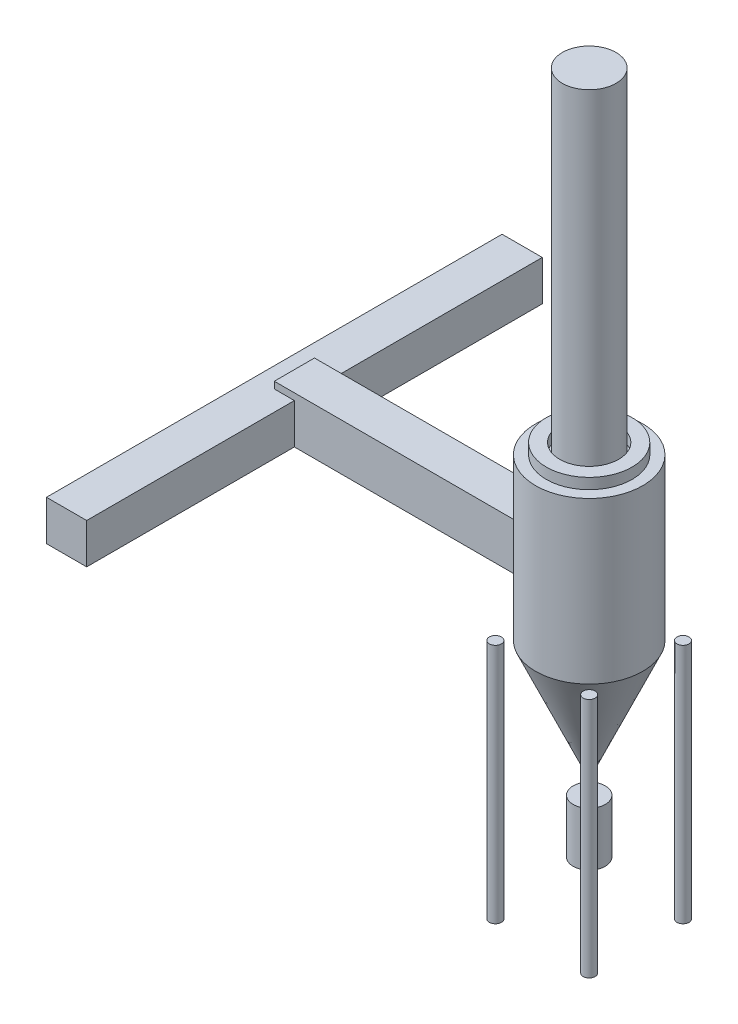
from build123d import *

# Parameters (mm, degrees)
SKETCH1_R            = 45
BOSS_EXTRUDE1_DEPTH  = 1800
SKETCH2_R            = 45
BOSS_EXTRUDE2_DEPTH  = 1800
SKETCH3_R            = 45
BOSS_EXTRUDE3_DEPTH  = 1800
SKETCH4_R            = 45
BOSS_EXTRUDE4_DEPTH  = 1800
BOSS_EXTRUDE5_START  = 400
SKETCH5_R            = 120
BOSS_EXTRUDE5_DEPTH  = 400
BOSS_EXTRUDE7_START  = 1800
SKETCH7_R            = 400
BOSS_EXTRUDE7_DEPTH  = 1200
BOSS_EXTRUDE8_START  = 3000
SKETCH8_R            = 200
BOSS_EXTRUDE8_DEPTH  = 2500
BOSS_EXTRUDE9_START  = 3000
SKETCH9_R            = 320
SKETCH9_R_2          = 220
BOSS_EXTRUDE9_DEPTH  = 80
BOSS_EXTRUDE10_START = 2100
SKETCH10_W           = 300
SKETCH10_H           = 3400
BOSS_EXTRUDE10_DEPTH = 300
BOSS_EXTRUDE11_START = 2100
SKETCH11_W           = 1800
SKETCH11_H           = 300
BOSS_EXTRUDE11_DEPTH = 350


with BuildPart() as part:
    # Sketch1 → Boss-Extrude1 (new body)
    with BuildSketch(Plane(origin=(0, 0, 0), x_dir=(1, 0, 0), z_dir=(0, 1, 0))):
        with Locations(Location((1850, 5150, 0), (0, 0, 270))):
            Circle(SKETCH1_R)
    extrude(amount=BOSS_EXTRUDE1_DEPTH)


with BuildPart() as body_2:
    # Sketch2 → Boss-Extrude2 (new body)
    with BuildSketch(Plane(origin=(0, 0, 0), x_dir=(1, 0, 0), z_dir=(0, 1, 0))):
        with Locations(Location((2550, 5150, 0), (0, 0, 270))):
            Circle(SKETCH2_R)
    extrude(amount=BOSS_EXTRUDE2_DEPTH)


with BuildPart() as body_3:
    # Sketch3 → Boss-Extrude3 (new body)
    with BuildSketch(Plane(origin=(0, 0, 0), x_dir=(1, 0, 0), z_dir=(0, 1, 0))):
        with Locations(Location((1850, 5850, 0), (0, 0, 270))):
            Circle(SKETCH3_R)
    extrude(amount=BOSS_EXTRUDE3_DEPTH)


with BuildPart() as body_4:
    # Sketch4 → Boss-Extrude4 (new body)
    with BuildSketch(Plane(origin=(0, 0, 0), x_dir=(1, 0, 0), z_dir=(0, 1, 0))):
        with Locations(Location((2550, 5850, 0), (0, 0, 270))):
            Circle(SKETCH4_R)
    extrude(amount=BOSS_EXTRUDE4_DEPTH)


with BuildPart() as body_5:
    # Sketch5 → Boss-Extrude5 (new body)
    with BuildSketch(Plane(origin=(0, 0, 0), x_dir=(1, 0, 0), z_dir=(0, 1, 0)).offset(BOSS_EXTRUDE5_START)):
        with Locations(Location((2200, 5500, 0), (0, 0, 270))):
            Circle(SKETCH5_R)
    extrude(amount=BOSS_EXTRUDE5_DEPTH)


with BuildPart() as body_6:
    # Boss-Extrude6 cone 1 section (through the dimple's axis) → Boss-Extrude6 (revolve)
    with BuildSketch(Plane(origin=(2200, 1800, -5500), x_dir=(0, 0, 1), z_dir=(1, 0, 0))):
        Polygon((0, 0), (400, 0), (0, 898.414709562), align=None)
    revolve(axis=Axis((2200, 1800, -5500), (0, -1, 0)))

    # Sketch7 → Boss-Extrude7 (add)
    with BuildSketch(Plane(origin=(0, 0, 0), x_dir=(1, 0, 0), z_dir=(0, 1, 0)).offset(BOSS_EXTRUDE7_START)):
        with Locations(Location((2200, 5500, 0), (0, 0, 270))):
            Circle(SKETCH7_R)
    extrude(amount=BOSS_EXTRUDE7_DEPTH)

    # Sketch8 → Boss-Extrude8 (add)
    with BuildSketch(Plane(origin=(0, 0, 0), x_dir=(1, 0, 0), z_dir=(0, 1, 0)).offset(BOSS_EXTRUDE8_START)):
        with Locations(Location((2200, 5500, 0), (0, 0, 270))):
            Circle(SKETCH8_R)
    extrude(amount=BOSS_EXTRUDE8_DEPTH)

    # Sketch9 → Boss-Extrude9 (add)
    with BuildSketch(Plane(origin=(0, 0, 0), x_dir=(1, 0, 0), z_dir=(0, 1, 0)).offset(BOSS_EXTRUDE9_START)):
        with Locations(Location((2200, 5500, 0), (0, 0, 270))):
            Circle(SKETCH9_R)
        with Locations(Location((2200, 5500, 0), (0, 0, 270))):
            Circle(SKETCH9_R_2, mode=Mode.SUBTRACT)
    extrude(amount=BOSS_EXTRUDE9_DEPTH)


with BuildPart() as body_7:
    # Sketch10 → Boss-Extrude10 (new body)
    with BuildSketch(Plane(origin=(0, 0, 0), x_dir=(1, 0, 0), z_dir=(0, 1, 0)).offset(BOSS_EXTRUDE10_START)):
        with Locations((0, 5500)):
            Rectangle(SKETCH10_W, SKETCH10_H)
    extrude(amount=BOSS_EXTRUDE10_DEPTH)

    # Sketch11 → Boss-Extrude11 (add)
    with BuildSketch(Plane(origin=(0, 0, 0), x_dir=(1, 0, 0), z_dir=(0, 1, 0)).offset(BOSS_EXTRUDE11_START)):
        with Locations((900, 5500)):
            Rectangle(SKETCH11_W, SKETCH11_H)
    extrude(amount=BOSS_EXTRUDE11_DEPTH)


solid = Compound([part.part, body_2.part, body_3.part, body_4.part, body_5.part, body_6.part, body_7.part])
